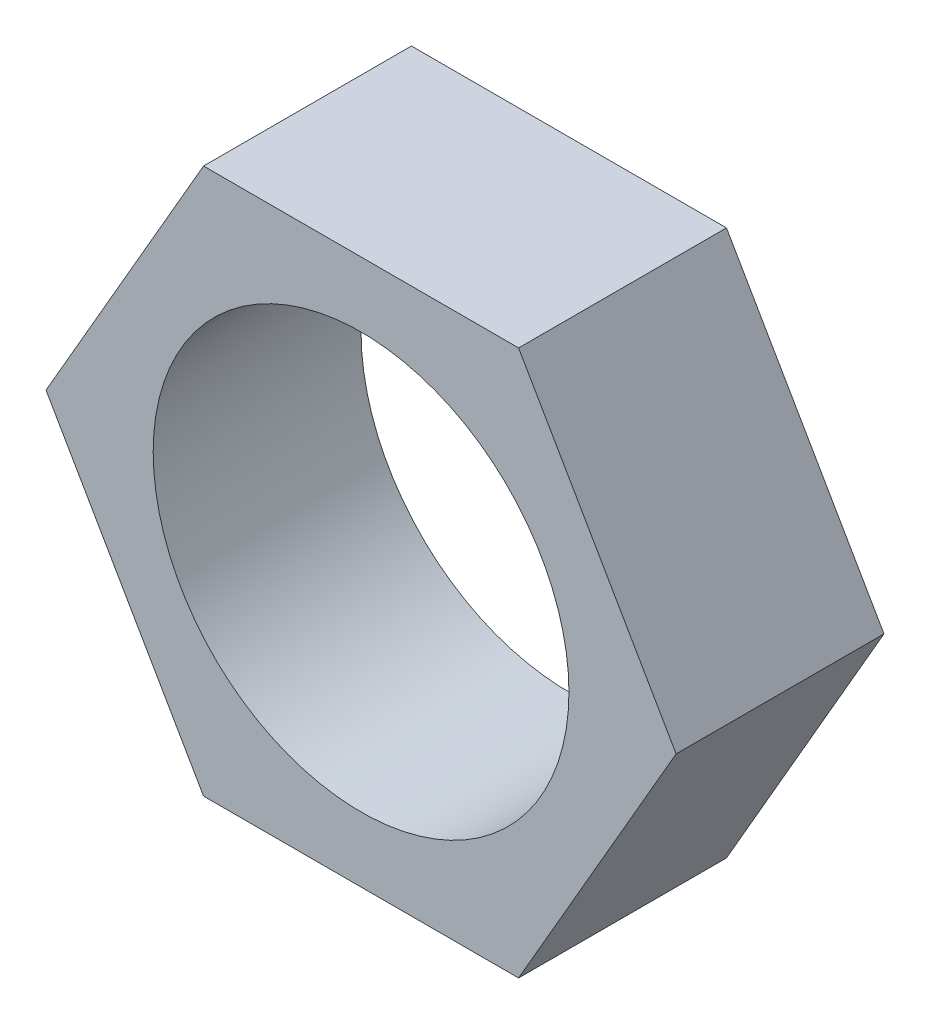
from build123d import *

# Parameters (mm, degrees)
SKETCH1_R           = 12.7
BOSS_EXTRUDE1_DEPTH = 12.7


with BuildPart() as part:
    # Sketch1 → Boss-Extrude1 (new body)
    with BuildSketch(Plane.XY):
        Polygon((19.247414599, 0), (9.6237073, 16.66875), (-9.6237073, 16.66875), (-19.247414599, 0), (-9.6237073, -16.66875), (9.6237073, -16.66875), align=None)
        Circle(SKETCH1_R, mode=Mode.SUBTRACT)
    extrude(amount=BOSS_EXTRUDE1_DEPTH)


solid = part.part
